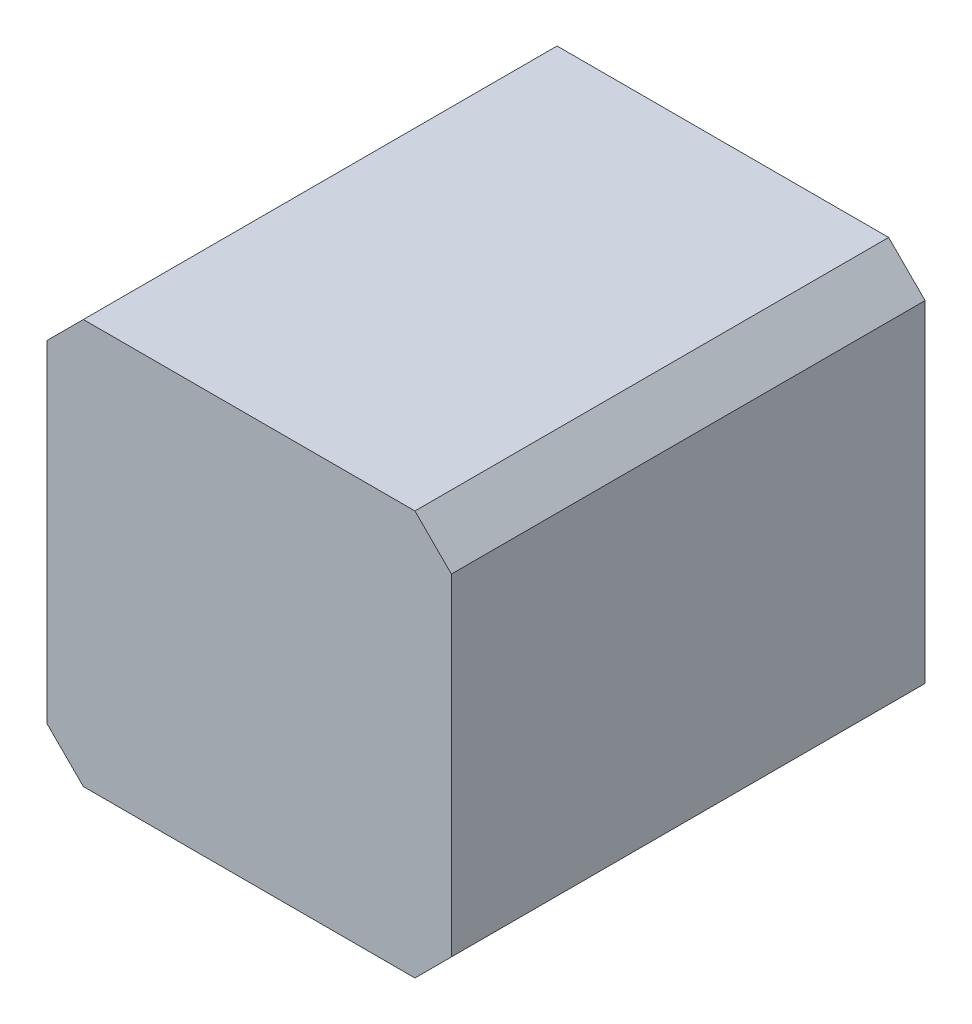
from build123d import *

# Parameters (mm, degrees)
SKETCH1_W           = 28.194
SKETCH1_H           = 28.194
BOSS_EXTRUDE1_DEPTH = 33.02
SKETCH3_R           = 10.9982
BOSS_EXTRUDE2_DEPTH = 1.778
SKETCH5_R           = 3.175
CUT_EXTRUDE1_DEPTH  = 5.08
CHAMFER1_SIZE       = 2.54


with BuildPart() as part:
    # Sketch1 → Boss-Extrude1 (new body)
    with BuildSketch(Plane.XY):
        Rectangle(SKETCH1_W, SKETCH1_H)
    extrude(amount=BOSS_EXTRUDE1_DEPTH)

    # Sketch3 → Boss-Extrude2 (add)
    with BuildSketch(Plane(origin=(0, 0, 0), x_dir=(-1, 0, 0), z_dir=(0, 0, -1))):
        Circle(SKETCH3_R)
    extrude(amount=BOSS_EXTRUDE2_DEPTH)

    # Sketch5 → Cut-Extrude1 (cut)
    with BuildSketch(Plane(origin=(0, 0, -1.778), x_dir=(-1, 0, 0), z_dir=(0, 0, -1))):
        Circle(SKETCH5_R)
    extrude(amount=-CUT_EXTRUDE1_DEPTH, mode=Mode.SUBTRACT)

    # Chamfer1
    chamfer1_edges = [part.edges().sort_by_distance(p)[0] for p in [
        (-14.097, 14.097, 16.51),
        (14.097, 14.097, 16.51),
        (14.097, -14.097, 16.51),
        (-14.097, -14.097, 16.51),
    ]]
    chamfer(chamfer1_edges, length=CHAMFER1_SIZE)


solid = part.part
